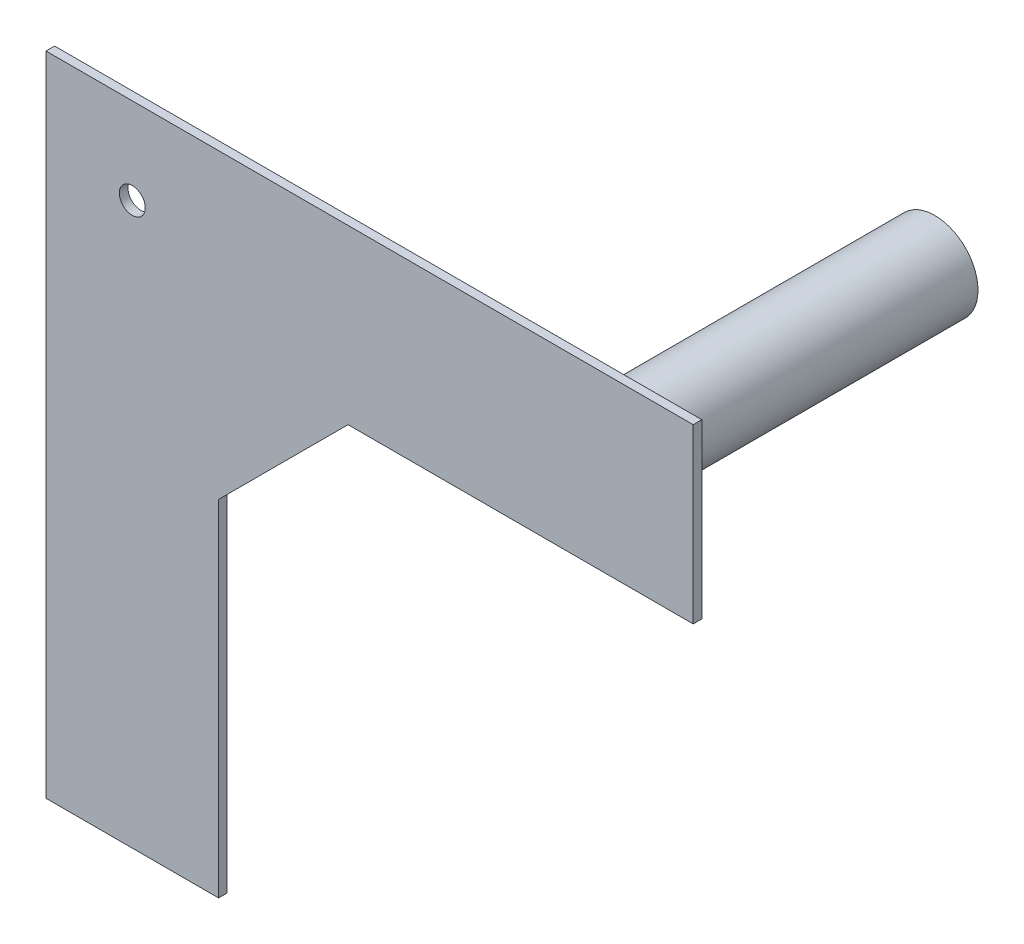
from build123d import *

# Parameters (mm, degrees)
BOSS_EXTRUDE1_DEPTH = 1
SKETCH4_R           = 1.5
CUT_EXTRUDE5_DEPTH  = 1
SKETCH5_R           = 5
BOSS_EXTRUDE2_DEPTH = 40


with BuildPart() as part:
    # Sketch1 → Boss-Extrude1 (new body)
    with BuildSketch(Plane.XY):
        Polygon((-20, 35), (-20, -40), (0, -40), (0, 0), (15, 15), (55, 15), (55, 35), align=None)
    extrude(amount=BOSS_EXTRUDE1_DEPTH)

    # Sketch4 → Cut-Extrude5 (cut)
    with BuildSketch(Plane.XY.offset(1)):
        with Locations((-10, 25.000149563)):
            Circle(SKETCH4_R)
    extrude(amount=-CUT_EXTRUDE5_DEPTH, mode=Mode.SUBTRACT)

    # Sketch5 → Boss-Extrude2 (add)
    with BuildSketch(Plane.XY.offset(1)):
        with Locations((43.007008147, 25)):
            Circle(SKETCH5_R)
    extrude(amount=-BOSS_EXTRUDE2_DEPTH)


solid = part.part
